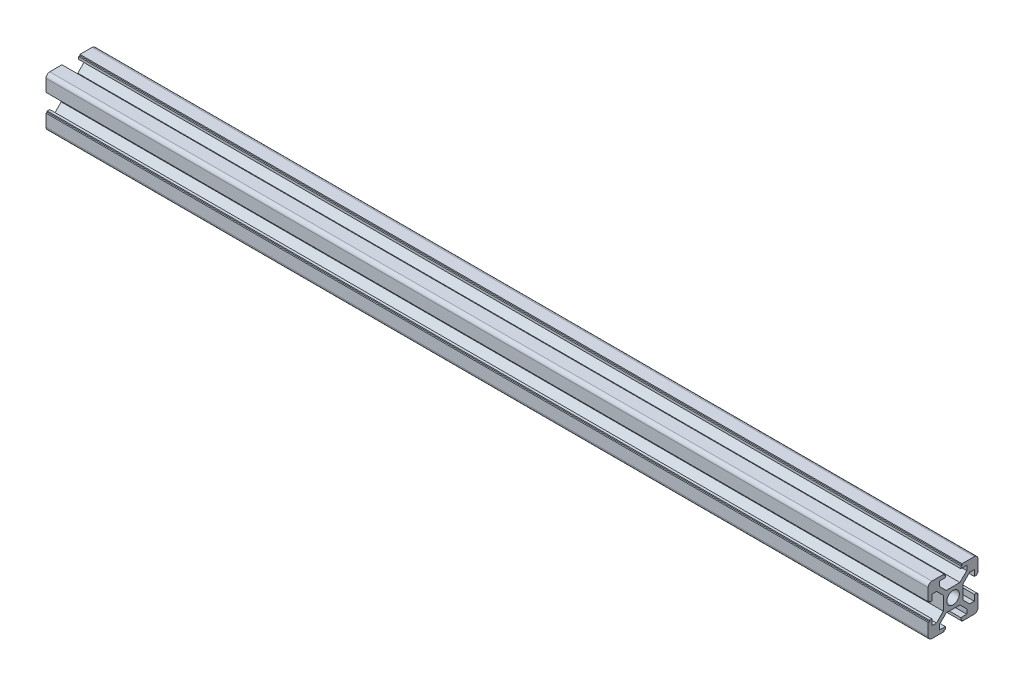
from build123d import *

# Parameters (mm, degrees)
SKETCH1_R                = 2.5
F_20_X_20_X_R1_5_1_DEPTH = 354


with BuildPart() as part:
    # Sketch1 → 铝型材 20 X 20 X R1.5(1) (new body)
    with BuildSketch(Plane(origin=(0, 0, 0), x_dir=(0, 0, -1), z_dir=(1, 0, 0))):
        with BuildLine():
            Line((-3.6, 10), (-3.6, 9.5))
            Line((-3.6, 9.5), (-3.1, 9.5))
            Line((-3.1, 9.5), (-3.1, 8.5))
            Line((-3.1, 8.5), (-5.5, 8.5))
            Line((-5.5, 8.5), (-5.5, 6.65))
            Line((-5.5, 6.65), (-2.75, 3.9))
            Line((-2.75, 3.9), (2.75, 3.9))
            Line((2.75, 3.9), (5.5, 6.65))
            Line((5.5, 6.65), (5.5, 8.5))
            Line((5.5, 8.5), (3.1, 8.5))
            Line((3.1, 8.5), (3.1, 9.5))
            Line((3.1, 9.5), (3.6, 9.5))
            Line((3.6, 9.5), (3.6, 10))
            Line((3.6, 10), (8.5, 10))
            ThreePointArc((8.5, 10), (9.560660172, 9.560660172), (10, 8.5))
            Line((10, 8.5), (10, 3.6))
            Line((10, 3.6), (9.5, 3.6))
            Line((9.5, 3.6), (9.5, 3.1))
            Line((9.5, 3.1), (8.5, 3.1))
            Line((8.5, 3.1), (8.5, 5.5))
            Line((8.5, 5.5), (6.65, 5.5))
            Line((6.65, 5.5), (3.9, 2.75))
            Line((3.9, 2.75), (3.9, -2.75))
            Line((3.9, -2.75), (6.65, -5.5))
            Line((6.65, -5.5), (8.5, -5.5))
            Line((8.5, -5.5), (8.5, -3.1))
            Line((8.5, -3.1), (9.5, -3.1))
            Line((9.5, -3.1), (9.5, -3.6))
            Line((9.5, -3.6), (10, -3.6))
            Line((10, -3.6), (10, -8.5))
            ThreePointArc((10, -8.5), (9.560660172, -9.560660172), (8.5, -10))
            Line((8.5, -10), (3.6, -10))
            Line((3.6, -10), (3.6, -9.5))
            Line((3.6, -9.5), (3.1, -9.5))
            Line((3.1, -9.5), (3.1, -8.5))
            Line((3.1, -8.5), (5.5, -8.5))
            Line((5.5, -8.5), (5.5, -6.65))
            Line((5.5, -6.65), (2.75, -3.9))
            Line((2.75, -3.9), (-2.75, -3.9))
            Line((-2.75, -3.9), (-5.5, -6.65))
            Line((-5.5, -6.65), (-5.5, -8.5))
            Line((-5.5, -8.5), (-3.1, -8.5))
            Line((-3.1, -8.5), (-3.1, -9.5))
            Line((-3.1, -9.5), (-3.6, -9.5))
            Line((-3.6, -9.5), (-3.6, -10))
            Line((-3.6, -10), (-8.5, -10))
            ThreePointArc((-8.5, -10), (-9.560660172, -9.560660172), (-10, -8.5))
            Line((-10, -8.5), (-10, -3.6))
            Line((-10, -3.6), (-9.5, -3.6))
            Line((-9.5, -3.6), (-9.5, -3.1))
            Line((-9.5, -3.1), (-8.5, -3.1))
            Line((-8.5, -3.1), (-8.5, -5.5))
            Line((-8.5, -5.5), (-6.65, -5.5))
            Line((-6.65, -5.5), (-3.9, -2.75))
            Line((-3.9, -2.75), (-3.9, 2.75))
            Line((-3.9, 2.75), (-6.65, 5.5))
            Line((-6.65, 5.5), (-8.5, 5.5))
            Line((-8.5, 5.5), (-8.5, 3.1))
            Line((-8.5, 3.1), (-9.5, 3.1))
            Line((-9.5, 3.1), (-9.5, 3.6))
            Line((-9.5, 3.6), (-10, 3.6))
            Line((-10, 3.6), (-10, 8.5))
            ThreePointArc((-10, 8.5), (-9.560660172, 9.560660172), (-8.5, 10))
            Line((-8.5, 10), (-3.6, 10))
        make_face()
        Circle(SKETCH1_R, mode=Mode.SUBTRACT)
    extrude(amount=F_20_X_20_X_R1_5_1_DEPTH)


solid = part.part
